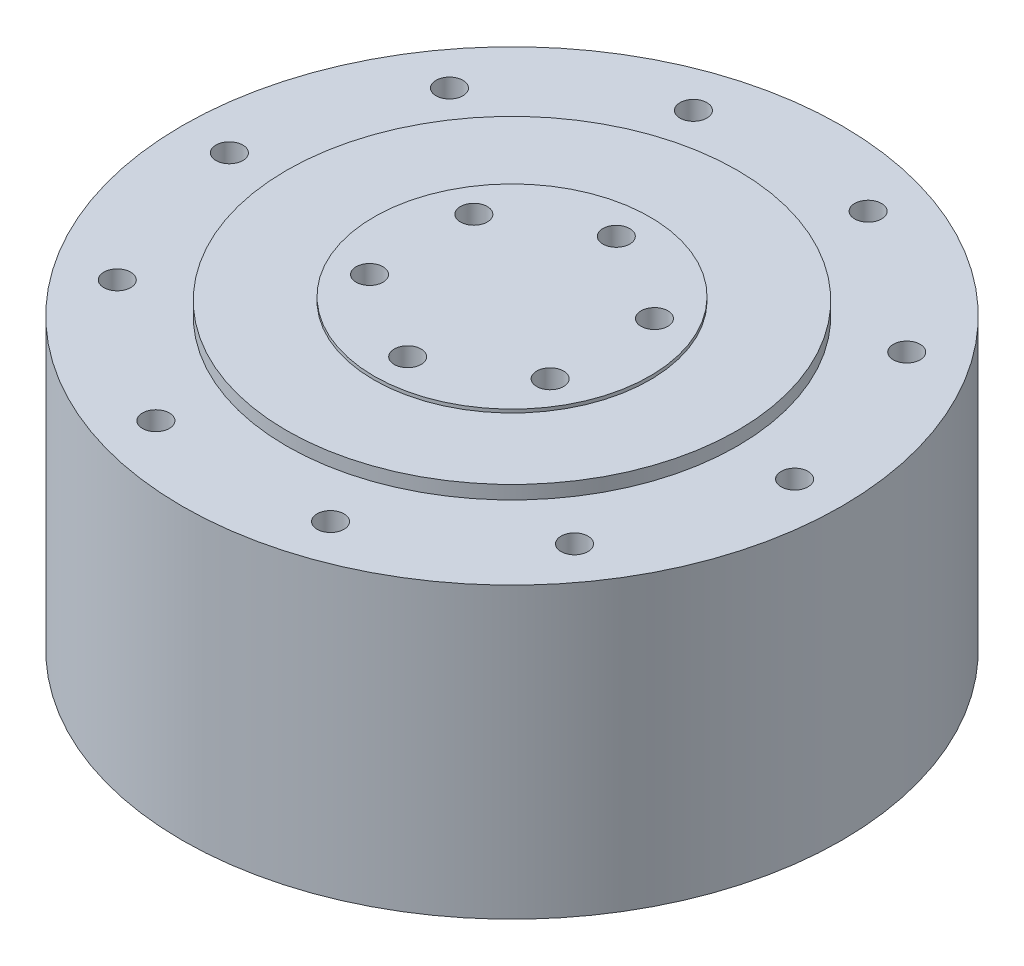
from build123d import *

# Parameters (mm, degrees)
SKETCH_1_R               = 49
EXTRUDE_1_DEPTH          = 43
SKETCH_2_R               = 33.5
EXTRUDE_2_DEPTH          = 2
SKETCH_4_R               = 20.5
EXTRUDE_4_DEPTH          = 0.5
SKETCH_5_R               = 2
CUT_EXTRUDE_1_DEPTH      = 5
PATTERN_CIRCULAR_1_COUNT = 6
SKETCH_6_R               = 2
CUT_EXTRUDE_2_DEPTH      = 5
PATTERN_CIRCULAR_2_COUNT = 10
CUT_EXTRUDE_START        = -5
SKETCH_7_R               = 2
CUT_EXTRUDE_3_DEPTH      = 5
PATTERN_CIRCULAR_3_COUNT = 10


with BuildPart() as part:
    # 草圖1 → 填料-伸長1 (new body)
    with BuildSketch(Plane(origin=(0, 0, 0), x_dir=(1, 0, 0), z_dir=(0, 1, 0))):
        with Locations(Location((0, 0, 0), (0, 0, 270))):
            Circle(SKETCH_1_R)
    extrude(amount=EXTRUDE_1_DEPTH)

    # 草圖2 → 填料-伸長2 (add)
    with BuildSketch(Plane(origin=(0, 43, 0), x_dir=(1, 0, 0), z_dir=(0, 1, 0))):
        with Locations(Location((0, 0, 0), (0, 0, 270))):
            Circle(SKETCH_2_R)
    extrude(amount=EXTRUDE_2_DEPTH)

    # 草圖4 → 填料-伸長4 (add)
    with BuildSketch(Plane(origin=(0, 45, 0), x_dir=(1, 0, 0), z_dir=(0, 1, 0))):
        with Locations(Location((0, 0, 0), (0, 0, 270))):
            Circle(SKETCH_4_R)
    extrude(amount=EXTRUDE_4_DEPTH)

    # 草圖5 → 除料-伸長1 (cut)
    with BuildSketch(Plane(origin=(0, 45.5, 0), x_dir=(1, 0, 0), z_dir=(0, 1, 0))):
        with Locations(Location((0, 15.5, 0), (0, 0, 270))):
            Circle(SKETCH_5_R)
    cut_extrude_1 = extrude(amount=-CUT_EXTRUDE_1_DEPTH, mode=Mode.SUBTRACT)

    # 環狀複製排列1: 除料-伸長1 ×6 about axis
    pattern_circular_1_axis = Axis((0, 0, 0), (0, 1, 0))
    for i in range(1, PATTERN_CIRCULAR_1_COUNT):
        add(cut_extrude_1.rotate(pattern_circular_1_axis, i * 360 / PATTERN_CIRCULAR_1_COUNT), mode=Mode.SUBTRACT)

    # 草圖6 → 除料-伸長2 (cut)
    with BuildSketch(Plane(origin=(0, 43, 0), x_dir=(1, 0, 0), z_dir=(0, 1, 0))):
        with Locations(Location((-42, 0, 0), (0, 0, 270))):
            Circle(SKETCH_6_R)
    cut_extrude_2 = extrude(amount=-CUT_EXTRUDE_2_DEPTH, mode=Mode.SUBTRACT)

    # 環狀複製排列2: 除料-伸長2 ×10 about axis
    pattern_circular_2_axis = Axis((0, 0, 0), (0, 1, 0))
    for i in range(1, PATTERN_CIRCULAR_2_COUNT):
        add(cut_extrude_2.rotate(pattern_circular_2_axis, i * 360 / PATTERN_CIRCULAR_2_COUNT), mode=Mode.SUBTRACT)

    # 草圖7 → 除料-伸長3 (cut)
    with BuildSketch(Plane.XZ.offset(CUT_EXTRUDE_START)):
        with Locations(Location((42, 0, 0), (0, 0, 270))):
            Circle(SKETCH_7_R)
    cut_extrude_3 = extrude(amount=CUT_EXTRUDE_3_DEPTH, mode=Mode.SUBTRACT)

    # 環狀複製排列3: 除料-伸長3 ×10 about axis
    pattern_circular_3_axis = Axis((0, 0, 0), (0, 1, 0))
    for i in range(1, PATTERN_CIRCULAR_3_COUNT):
        add(cut_extrude_3.rotate(pattern_circular_3_axis, i * 360 / PATTERN_CIRCULAR_3_COUNT), mode=Mode.SUBTRACT)


solid = part.part
